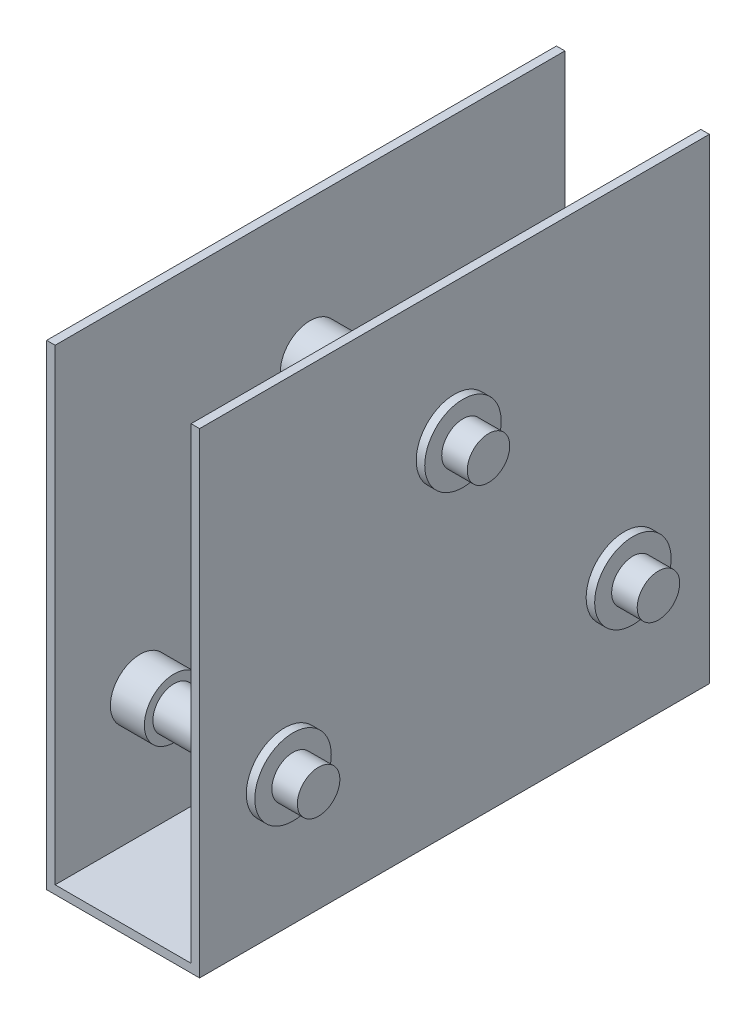
from build123d import *

# Parameters (mm, degrees)
BOSS_EXTRUDE1_DEPTH      = 95.25
BOSS_EXTRUDE2_DEPTH      = 1.5875
BOSS_EXTRUDE2_DEPTH_BACK = 30.1625
SKETCH3_R                = 5.55625
SKETCH4_R                = 7.14375
BOSS_EXTRUDE3_DEPTH      = 1.5875
BOSS_EXTRUDE4_START      = 1.5875
SKETCH5_R                = 7.14375
BOSS_EXTRUDE4_DEPTH      = 1.5875
SKETCH7_W                = 12.7
SKETCH7_H                = 95.25
CUT_EXTRUDE1_DEPTH       = 131.184679518
BOSS_EXTRUDE5_DEPTH      = 6.35
BOSS_EXTRUDE5_DEPTH_BACK = 34.9377
SKETCH6_R                = 3.96875


with BuildPart() as part:
    # Sketch1 → Boss-Extrude1 (new body)
    with BuildSketch(Plane.XY):
        Polygon((-14.2875, 88.9), (-14.2875, 0), (14.2875, 0), (14.2875, 88.9), (12.7, 88.9), (12.7, 1.5875), (-12.7, 1.5875), (-12.7, 88.9), align=None)
    extrude(amount=BOSS_EXTRUDE1_DEPTH)

    # Sketch3 → Boss-Extrude2 (add, two sides: drawn at the far end of the back side and taken through both)
    with BuildSketch(Plane(origin=(14.2875, 0, 0), x_dir=(0, 0, -1), z_dir=(1, 0, 0)).offset(-BOSS_EXTRUDE2_DEPTH_BACK)):
        with Locations(Location((-47.625, 63.5, 0), (0, 0, 90))):
            Circle(SKETCH3_R)
        with Locations(Location((-79.375, 25.4, 0), (0, 0, 90))):
            Circle(SKETCH3_R)
        with Locations(Location((-15.875, 25.4, 0), (0, 0, 90))):
            Circle(SKETCH3_R)
    extrude(amount=BOSS_EXTRUDE2_DEPTH + BOSS_EXTRUDE2_DEPTH_BACK)

    # Sketch4 → Boss-Extrude3 (add)
    with BuildSketch(Plane(origin=(14.2875, 0, 0), x_dir=(0, 0, -1), z_dir=(1, 0, 0))):
        with Locations(Location((-47.625, 63.5, 0), (0, 0, 270))):
            Circle(SKETCH4_R)
        with Locations(Location((-15.875, 25.4, 0), (0, 0, 270))):
            Circle(SKETCH4_R)
        with Locations(Location((-79.375, 25.4, 0), (0, 0, 270))):
            Circle(SKETCH4_R)
    extrude(amount=BOSS_EXTRUDE3_DEPTH)

    # Sketch5 → Boss-Extrude4 (add)
    with BuildSketch(Plane.ZY.offset(14.2875).offset(BOSS_EXTRUDE4_START)):
        with Locations(Location((47.625, 63.5, 0), (0, 0, 270))):
            Circle(SKETCH5_R)
        with Locations(Location((79.375, 25.4, 0), (0, 0, 270))):
            Circle(SKETCH5_R)
        with Locations(Location((15.875, 25.4, 0), (0, 0, 270))):
            Circle(SKETCH5_R)
    extrude(amount=-BOSS_EXTRUDE4_DEPTH)

    # Sketch7 → Cut-Extrude1 (cut, through all)
    with BuildSketch(Plane(origin=(0, 1.5875, 0), x_dir=(1, 0, 0), z_dir=(0, 1, 0))):
        with Locations((0, -47.625)):
            Rectangle(SKETCH7_W, SKETCH7_H)
    extrude(amount=CUT_EXTRUDE1_DEPTH, mode=Mode.SUBTRACT)

    # Sketch6 → Boss-Extrude5 (add, two sides: drawn at the far end of the back side and taken through both)
    with BuildSketch(Plane.ZY.offset(14.2875).offset(-BOSS_EXTRUDE5_DEPTH_BACK)):
        with Locations((47.625, 63.5)):
            Circle(SKETCH6_R)
        with Locations((79.375, 25.4)):
            Circle(SKETCH6_R)
        with Locations((15.875, 25.4)):
            Circle(SKETCH6_R)
    extrude(amount=BOSS_EXTRUDE5_DEPTH + BOSS_EXTRUDE5_DEPTH_BACK)


solid = part.part
